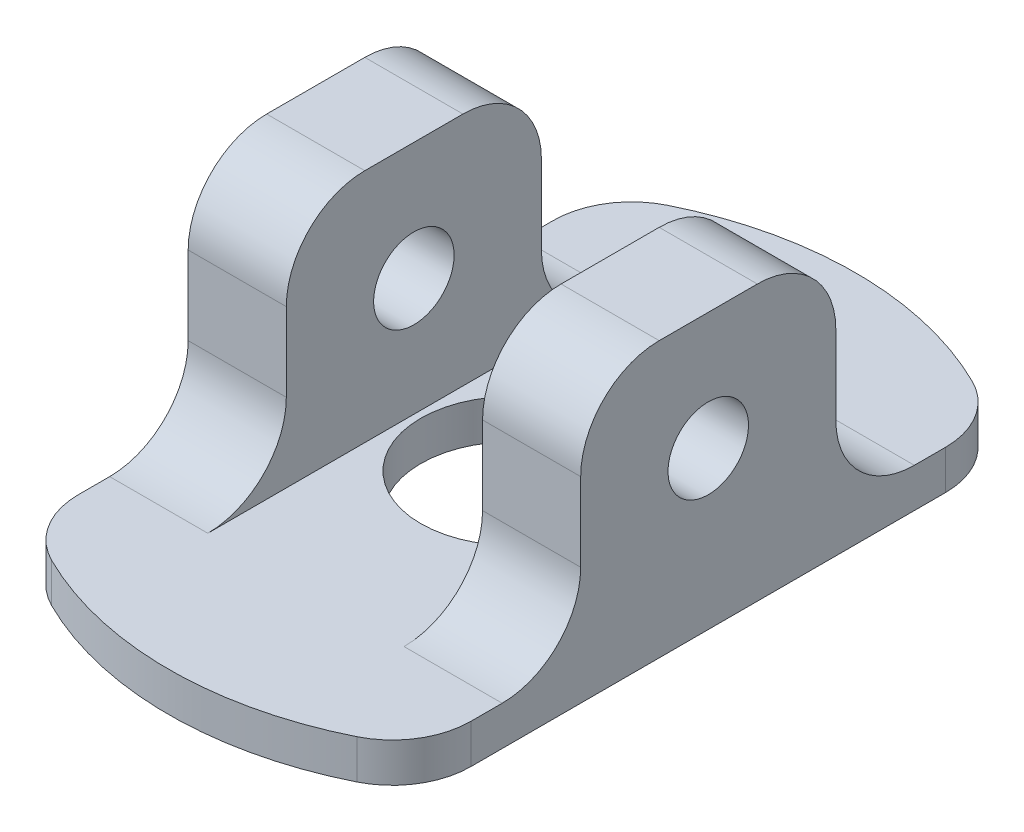
from build123d import *

# Parameters (mm, degrees)
SKETCH1_R           = 4.65
BOSS_EXTRUDE1_DEPTH = 12
SKETCH2_R           = 17.5
BOSS_EXTRUDE2_DEPTH = 2
SKETCH3_W           = 5
SKETCH3_H           = 13
BOSS_EXTRUDE3_DEPTH = 12
FILLET1_R           = 4
FILLET2_R           = 4
CUT_EXTRUDE1_DEPTH  = 29.434134416
SKETCH5_R           = 2.05
CUT_EXTRUDE2_DEPTH  = 70
FILLET3_R           = 4
SKETCH6_R           = 4.65
CUT_EXTRUDE3_DEPTH  = 33.897568299


with BuildPart() as part:
    # Sketch1 → Boss-Extrude1 (new body)
    with BuildSketch(Plane(origin=(0, 0, 0), x_dir=(1, 0, 0), z_dir=(0, 1, 0))):
        with Locations(Location((0, 0, 0), (0, 0, 270))):
            Circle(SKETCH1_R)
    extrude(amount=BOSS_EXTRUDE1_DEPTH)

    # Sketch2 → Boss-Extrude2 (add)
    with BuildSketch(Plane(origin=(0, 12, 0), x_dir=(1, 0, 0), z_dir=(0, 1, 0))):
        with Locations(Location((0, 0, 0), (0, 0, 270))):
            Circle(SKETCH2_R)
    extrude(amount=BOSS_EXTRUDE2_DEPTH)

    # Sketch3 → Boss-Extrude3 (add)
    with BuildSketch(Plane(origin=(0, 14, 0), x_dir=(1, 0, 0), z_dir=(0, 1, 0))):
        with Locations((7.5, 0)):
            Rectangle(SKETCH3_W, SKETCH3_H)
    boss_extrude3 = extrude(amount=BOSS_EXTRUDE3_DEPTH)

    # Mirror1: Boss-Extrude3 across plane
    add(boss_extrude3.mirror(Plane(origin=(0, 0, 0), x_dir=(0, 0, 1), z_dir=(1, 0, 0))))

    # Fillet1
    fillet1_edges = [part.edges().sort_by_distance(p)[0] for p in [
        (7.5, 26, -6.5),
        (7.5, 26, 6.5),
        (-7.5, 26, 6.5),
        (-7.5, 26, -6.5),
    ]]
    fillet(fillet1_edges, radius=FILLET1_R)

    # Fillet2
    fillet2_edges = [part.edges().sort_by_distance(p)[0] for p in [
        (7.5, 14, 6.5),
        (7.5, 14, -6.5),
        (-7.5, 14, -6.5),
        (-7.5, 14, 6.5),
    ]]
    fillet(fillet2_edges, radius=FILLET2_R)

    # Sketch4 → Cut-Extrude1 (cut, through all)
    with BuildSketch(Plane(origin=(0, 14, 0), x_dir=(1, 0, 0), z_dir=(0, 1, 0))):
        with BuildLine():
            Line((10, 14.361406616), (10, 0))
            Line((10, 0), (10, -14.361406616))
            ThreePointArc((10, -14.361406616), (15.512092057, -8.100925873), (17.5, 0))
            ThreePointArc((17.5, 0), (15.512092057, 8.100925873), (10, 14.361406616))
        make_face()
    cut_extrude1 = extrude(amount=-CUT_EXTRUDE1_DEPTH, mode=Mode.SUBTRACT)

    # Mirror2: Cut-Extrude1 across plane
    add(cut_extrude1.mirror(Plane(origin=(0, 0, 0), x_dir=(0, 0, 1), z_dir=(1, 0, 0))), mode=Mode.SUBTRACT)

    # Sketch5 → Cut-Extrude2 (cut)
    with BuildSketch(Plane(origin=(10, 0, 0), x_dir=(0, 0, -1), z_dir=(1, 0, 0))):
        with Locations((0, 20)):
            Circle(SKETCH5_R)
    extrude(amount=-CUT_EXTRUDE2_DEPTH, mode=Mode.SUBTRACT)

    # Fillet3
    fillet3_edges = [part.edges().sort_by_distance(p)[0] for p in [
        (10, 13, -14.361406616),
        (10, 13, 14.361406616),
        (-10, 13, 14.361406616),
        (-10, 13, -14.361406616),
    ]]
    fillet(fillet3_edges, radius=FILLET3_R)

    # Sketch6 → Cut-Extrude3 (cut, through all)
    with BuildSketch(Plane.XZ):
        with Locations(Location((0, 0, 0), (0, 0, 90))):
            Circle(SKETCH6_R)
    extrude(amount=-CUT_EXTRUDE3_DEPTH, mode=Mode.SUBTRACT)


solid = part.part
